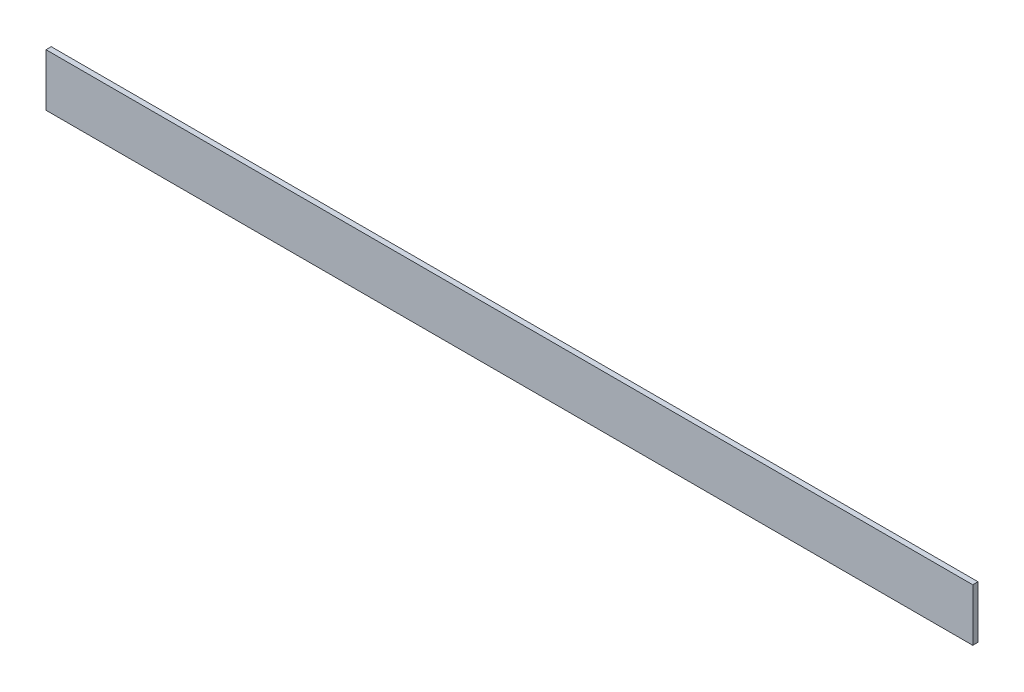
from build123d import *

# Parameters (mm, degrees)
EXTRUDE_1_DEPTH     = 530
SKETCH_2_W          = 30
SKETCH_2_H          = 27
CUT_EXTRUDE_1_DEPTH = 532.695401522


with BuildPart() as part:
    # Эскиз1 → Вытянуть-Тонкостенный1 (new body)
    with BuildSketch(Plane(origin=(0, 0, 0), x_dir=(0, 0, -1), z_dir=(1, 0, 0))):
        Polygon((0, 30), (0, 0), (30, 0), (30, 3), (3, 3), (3, 30), align=None)
    extrude(amount=EXTRUDE_1_DEPTH)

    # Эскиз2 → Вырез-Вытянуть1 (cut, through all)
    with BuildSketch(Plane.XZ):
        with Locations((515, -16.5)):
            Rectangle(SKETCH_2_W, SKETCH_2_H)
        with Locations((15, -16.5)):
            Rectangle(SKETCH_2_W, SKETCH_2_H)
    extrude(amount=-CUT_EXTRUDE_1_DEPTH, mode=Mode.SUBTRACT)


solid = part.part
